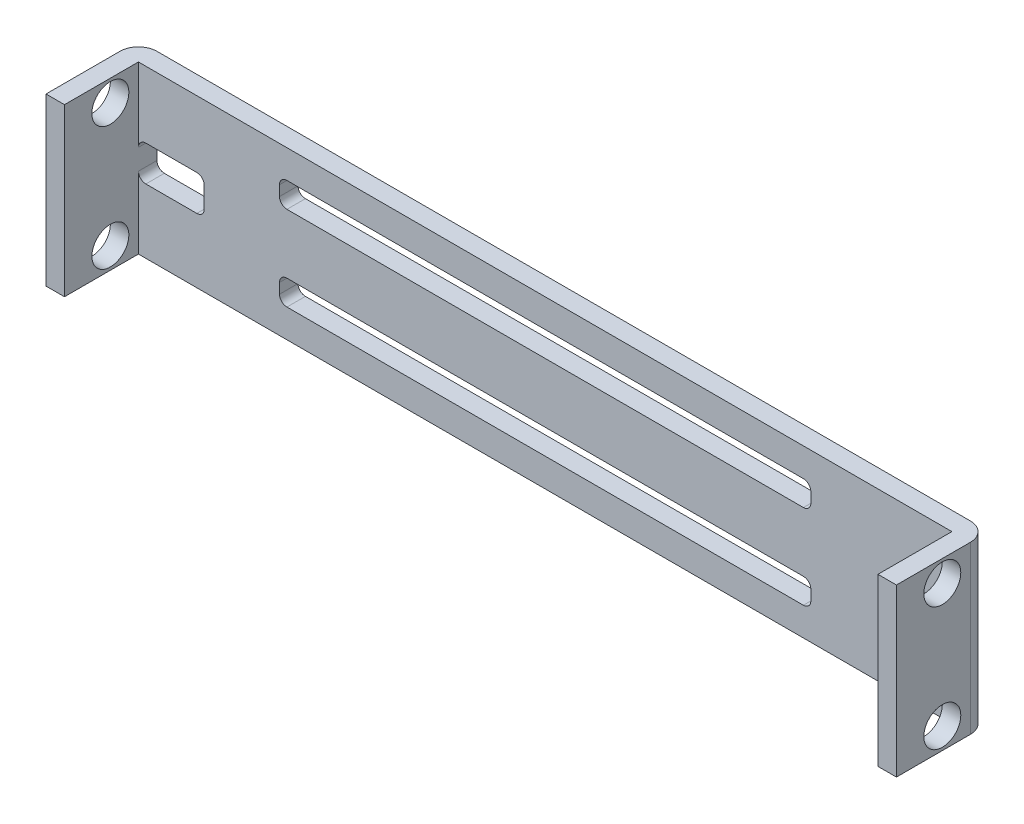
from build123d import *

# Parameters (mm, degrees)
SKETCH1_W               = 46
SKETCH1_H               = 9
BOSS_EXTRUDE1_DEPTH     = 1
SKETCH2_W               = 1
SKETCH2_H               = 9
BOSS_EXTRUDE2_DEPTH     = 4
CUT_EXTRUDE1_DEPTH      = 47.489246068
CUT_EXTRUDE1_DEPTH_BACK = 47.489246068
SKETCH3_R               = 1
FILLET1_R               = 1
CUT_EXTRUDE2_DEPTH      = 4


with BuildPart() as part:
    # Sketch1 → Boss-Extrude1 (new body)
    with BuildSketch(Plane.XY):
        Rectangle(SKETCH1_W, SKETCH1_H)
    extrude(amount=BOSS_EXTRUDE1_DEPTH)

    # Sketch2 → Boss-Extrude2 (add)
    with BuildSketch(Plane.XY.offset(1)):
        with Locations((22.5, 0)):
            Rectangle(SKETCH2_W, SKETCH2_H)
        with Locations((-22.5, 0)):
            Rectangle(SKETCH2_W, SKETCH2_H)
    extrude(amount=BOSS_EXTRUDE2_DEPTH)

    # Sketch3 → Cut-Extrude1 (cut, two sides: drawn at the far end of the back side and taken through both)
    with BuildSketch(Plane(origin=(23, 0, 0), x_dir=(0, 0, -1), z_dir=(1, 0, 0)).offset(-CUT_EXTRUDE1_DEPTH_BACK)):
        with Locations((-2.519595735, 3.342695185)):
            Circle(SKETCH3_R)
        with Locations(Location((-2.519595735, -3.342695185, 0), (0, 0, 180))):
            Circle(SKETCH3_R)
    extrude(amount=CUT_EXTRUDE1_DEPTH + CUT_EXTRUDE1_DEPTH_BACK, mode=Mode.SUBTRACT)

    # Fillet1
    fillet1_edges = [part.edges().sort_by_distance(p)[0] for p in [
        (23, 0, 0),
        (-23, 0, 0),
    ]]
    fillet(fillet1_edges, radius=FILLET1_R)

    # Sketch4 → Cut-Extrude2 (cut)
    with BuildSketch(Plane(origin=(0, 0, 0), x_dir=(-1, 0, 0), z_dir=(0, 0, -1))):
        with BuildLine():
            Line((-13.969166326, 1.612266409), (13.969166326, 1.612266409))
            ThreePointArc((13.969166326, 1.612266409), (14.252009038, 1.729423696), (14.369166326, 2.012266409))
            Line((14.369166326, 2.012266409), (14.369166326, 2.564662734))
            ThreePointArc((14.369166326, 2.564662734), (14.252009038, 2.847505447), (13.969166326, 2.964662734))
            Line((13.969166326, 2.964662734), (-13.969166326, 2.964662734))
            ThreePointArc((-13.969166326, 2.964662734), (-14.252009038, 2.847505447), (-14.369166326, 2.564662734))
            Line((-14.369166326, 2.564662734), (-14.369166326, 2.012266409))
            ThreePointArc((-14.369166326, 2.012266409), (-14.252009038, 1.729423696), (-13.969166326, 1.612266409))
        make_face()
        with BuildLine():
            Line((14.369166326, -2.012266409), (14.369166326, -2.564662734))
            ThreePointArc((14.369166326, -2.564662734), (14.252009038, -2.847505447), (13.969166326, -2.964662734))
            Line((13.969166326, -2.964662734), (-13.969166326, -2.964662734))
            ThreePointArc((-13.969166326, -2.964662734), (-14.252009038, -2.847505447), (-14.369166326, -2.564662734))
            Line((-14.369166326, -2.564662734), (-14.369166326, -2.012266409))
            ThreePointArc((-14.369166326, -2.012266409), (-14.252009038, -1.729423696), (-13.969166326, -1.612266409))
            Line((-13.969166326, -1.612266409), (13.969166326, -1.612266409))
            ThreePointArc((13.969166326, -1.612266409), (14.252009038, -1.729423696), (14.369166326, -2.012266409))
        make_face()
        with BuildLine():
            Line((-21.6, 0.901467355), (-18.840541252, 0.901467355))
            ThreePointArc((-18.840541252, 0.901467355), (-18.55769854, 0.784310067), (-18.440541252, 0.501467355))
            Line((-18.440541252, 0.501467355), (-18.440541252, -0.615256763))
            ThreePointArc((-18.440541252, -0.615256763), (-18.55769854, -0.898099475), (-18.840541252, -1.015256763))
            Line((-18.840541252, -1.015256763), (-21.6, -1.015256763))
            ThreePointArc((-21.6, -1.015256763), (-21.882842712, -0.898099475), (-22, -0.615256763))
            Line((-22, -0.615256763), (-22, 0.501467355))
            ThreePointArc((-22, 0.501467355), (-21.882842712, 0.784310067), (-21.6, 0.901467355))
        make_face()
        with BuildLine():
            Line((18.440541252, 0.501467355), (18.440541252, -0.615256763))
            ThreePointArc((18.440541252, -0.615256763), (18.55769854, -0.898099475), (18.840541252, -1.015256763))
            Line((18.840541252, -1.015256763), (21.6, -1.015256763))
            ThreePointArc((21.6, -1.015256763), (21.882842712, -0.898099475), (22, -0.615256763))
            Line((22, -0.615256763), (22, 0.501467355))
            ThreePointArc((22, 0.501467355), (21.882842712, 0.784310067), (21.6, 0.901467355))
            Line((21.6, 0.901467355), (18.840541252, 0.901467355))
            ThreePointArc((18.840541252, 0.901467355), (18.55769854, 0.784310067), (18.440541252, 0.501467355))
        make_face()
    extrude(amount=-CUT_EXTRUDE2_DEPTH, mode=Mode.SUBTRACT)


solid = part.part
